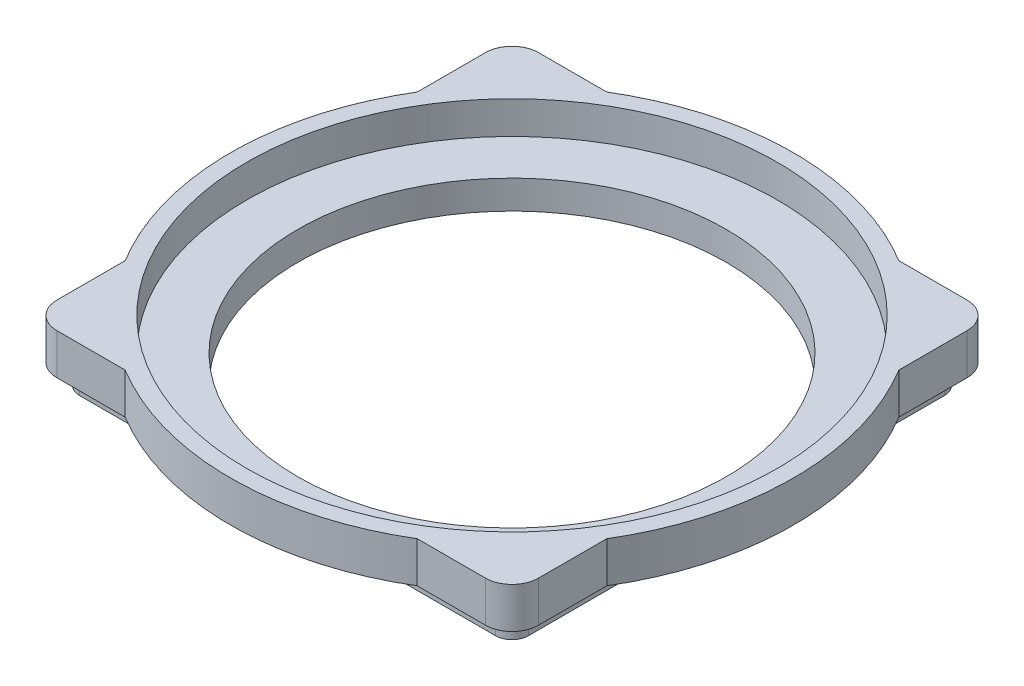
from build123d import *

# Parameters (mm, degrees)
SKETCH1_W           = 118
SKETCH1_H           = 118
BOSS_EXTRUDE1_DEPTH = 15
SKETCH2_W           = 118
SKETCH2_H           = 118
SKETCH2_W_2         = 110
SKETCH2_H_2         = 110
CUT_EXTRUDE1_DEPTH  = 5
SKETCH6_R           = 69
BOSS_EXTRUDE2_DEPTH = 10
SKETCH3_R           = 52.5
CUT_EXTRUDE2_DEPTH  = 99.726896031
SKETCH4_R           = 65
CUT_EXTRUDE3_DEPTH  = 8
FILLET1_R           = 4
FILLET2_R           = 6.5


with BuildPart() as part:
    # Sketch1 → Boss-Extrude1 (new body)
    with BuildSketch(Plane(origin=(0, 0, 0), x_dir=(1, 0, 0), z_dir=(0, 1, 0))):
        Rectangle(SKETCH1_W, SKETCH1_H)
    extrude(amount=BOSS_EXTRUDE1_DEPTH)

    # Sketch2 → Cut-Extrude1 (cut)
    with BuildSketch(Plane.XZ):
        Rectangle(SKETCH2_W, SKETCH2_H)
        Rectangle(SKETCH2_W_2, SKETCH2_H_2, mode=Mode.SUBTRACT)
    extrude(amount=-CUT_EXTRUDE1_DEPTH, mode=Mode.SUBTRACT)

    # Sketch6 → Boss-Extrude2 (add)
    with BuildSketch(Plane(origin=(0, 15, 0), x_dir=(1, 0, 0), z_dir=(0, 1, 0))):
        Circle(SKETCH6_R)
    extrude(amount=-BOSS_EXTRUDE2_DEPTH)

    # Sketch3 → Cut-Extrude2 (cut, through all)
    with BuildSketch(Plane(origin=(0, 15, 0), x_dir=(1, 0, 0), z_dir=(0, 1, 0))):
        with Locations(Location((0, 0, 0), (0, 0, 270))):
            Circle(SKETCH3_R)
    extrude(amount=-CUT_EXTRUDE2_DEPTH, mode=Mode.SUBTRACT)

    # Sketch4 → Cut-Extrude3 (cut)
    with BuildSketch(Plane(origin=(0, 15, 0), x_dir=(1, 0, 0), z_dir=(0, 1, 0))):
        with Locations(Location((0, 0, 0), (0, 0, 270))):
            Circle(SKETCH4_R)
    extrude(amount=-CUT_EXTRUDE3_DEPTH, mode=Mode.SUBTRACT)

    # Fillet1
    fillet1_edges = [part.edges().sort_by_distance(p)[0] for p in [
        (55, 2.5, -55),
        (-55, 2.5, -55),
        (-55, 2.5, 55),
        (55, 2.5, 55),
    ]]
    fillet(fillet1_edges, radius=FILLET1_R)

    # Fillet2
    fillet2_edges = [part.edges().sort_by_distance(p)[0] for p in [
        (-59, 10, -59),
        (59, 10, -59),
        (59, 10, 59),
        (-59, 10, 59),
    ]]
    fillet(fillet2_edges, radius=FILLET2_R)


solid = part.part
